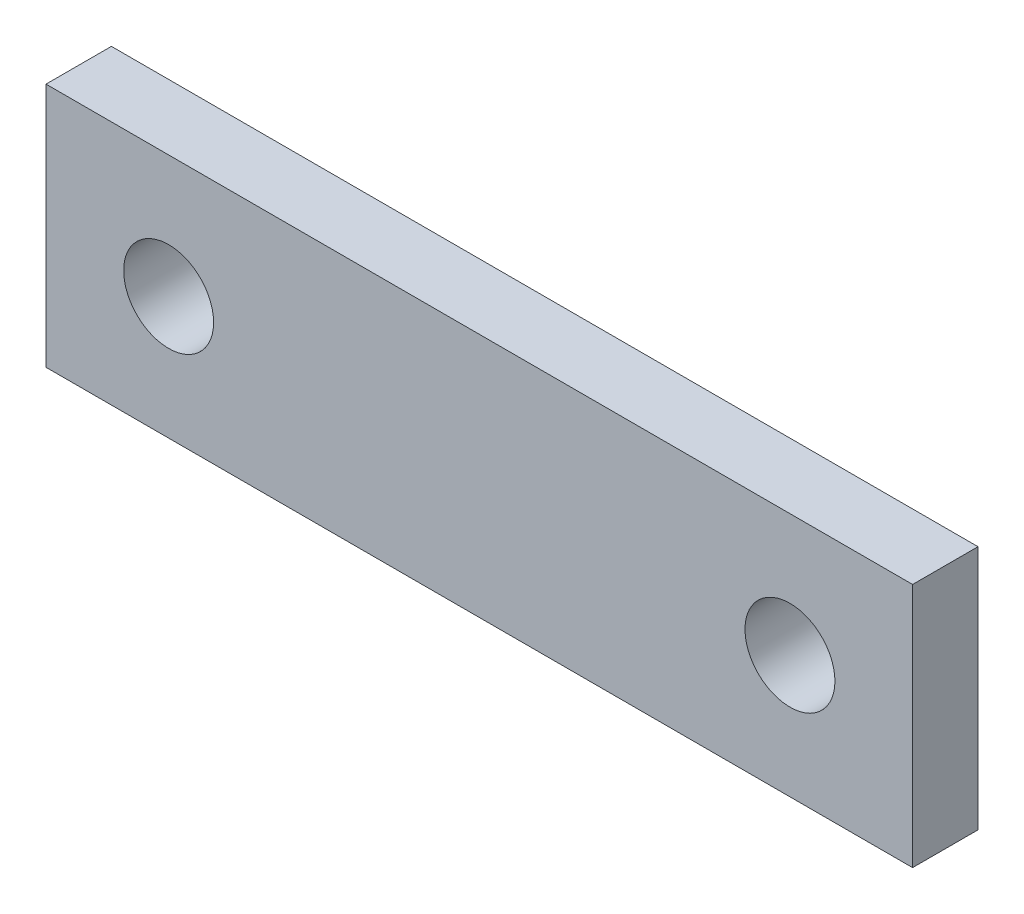
from build123d import *

# Parameters (mm, degrees)
SKETCH_1_W          = 212
SKETCH_1_H          = 60
EXTRUDE_1_DEPTH     = 16
SKETCH_2_R          = 11
CUT_EXTRUDE_2_DEPTH = 221.907220344


with BuildPart() as part:
    # 草图1 → 拉伸1 (new body)
    with BuildSketch(Plane.XY):
        with Locations((106, 30)):
            Rectangle(SKETCH_1_W, SKETCH_1_H)
    extrude(amount=EXTRUDE_1_DEPTH)

    # 草图2 → 拉伸2 (cut, through all)
    with BuildSketch(Plane.XY.offset(16)):
        with Locations((30, 30)):
            Circle(SKETCH_2_R)
        with Locations((182, 30)):
            Circle(SKETCH_2_R)
    extrude(amount=-CUT_EXTRUDE_2_DEPTH, mode=Mode.SUBTRACT)


solid = part.part
